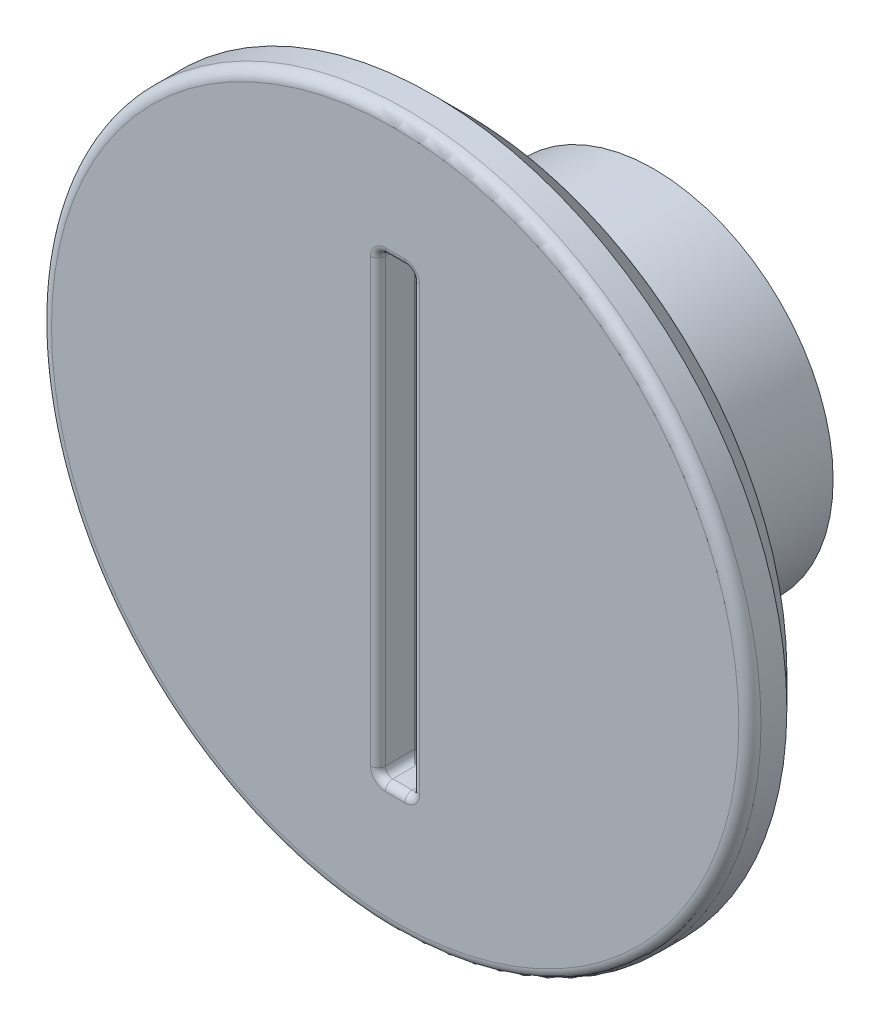
from build123d import *

# Parameters (mm, degrees)
SKETCH1_R           = 9.6
BOSS_EXTRUDE2_DEPTH = 2
CHAMFER1_SIZE       = 1
FILLET1_R           = 0.3
SKETCH2_W           = 0.926275652
SKETCH2_H           = 12.346112468
CUT_EXTRUDE1_DEPTH  = 1
FILLET2_R           = 0.2
SKETCH5_R           = 4.852441015
BOSS_EXTRUDE3_DEPTH = 5
FILLET3_R           = 0.4


with BuildPart() as part:
    # Sketch1 → Boss-Extrude2 (new body)
    with BuildSketch(Plane.XY):
        Circle(SKETCH1_R)
    extrude(amount=BOSS_EXTRUDE2_DEPTH)

    # Chamfer1
    chamfer1_edges = [part.edges().sort_by_distance(p)[0] for p in [
        (-9.6, 0, 0),
    ]]
    chamfer(chamfer1_edges, length=CHAMFER1_SIZE)

    # Fillet1
    fillet1_edges = [part.edges().sort_by_distance(p)[0] for p in [
        (-9.6, 0, 2),
    ]]
    fillet(fillet1_edges, radius=FILLET1_R)

    # Sketch2 → Cut-Extrude1 (cut)
    with BuildSketch(Plane.XY.offset(2)):
        Rectangle(SKETCH2_W, SKETCH2_H)
    extrude(amount=-CUT_EXTRUDE1_DEPTH, mode=Mode.SUBTRACT)

    # Fillet2
    fillet2_edges = [part.edges().sort_by_distance(p)[0] for p in [
        (0, 6.173056234, 2),
        (-0.463137826, 0, 2),
        (0.463137826, 0, 2),
        (-0.463137826, -6.173056234, 1.5),
        (0, -6.173056234, 1),
        (0.463137826, -6.173056234, 1.5),
        (0, -6.173056234, 2),
        (0.463137826, 6.173056234, 1.5),
        (-0.463137826, 6.173056234, 1.5),
    ]]
    fillet(fillet2_edges, radius=FILLET2_R)

    # Sketch5 → Boss-Extrude3 (add)
    with BuildSketch(Plane(origin=(0, 0, 0), x_dir=(-1, 0, 0), z_dir=(0, 0, -1))):
        Circle(SKETCH5_R)
    extrude(amount=BOSS_EXTRUDE3_DEPTH)

    # Fillet3
    fillet3_edges = [part.edges().sort_by_distance(p)[0] for p in [
        (4.852441015, 0, 0),
        (-8.6, 0, 0),
    ]]
    fillet(fillet3_edges, radius=FILLET3_R)


solid = part.part
